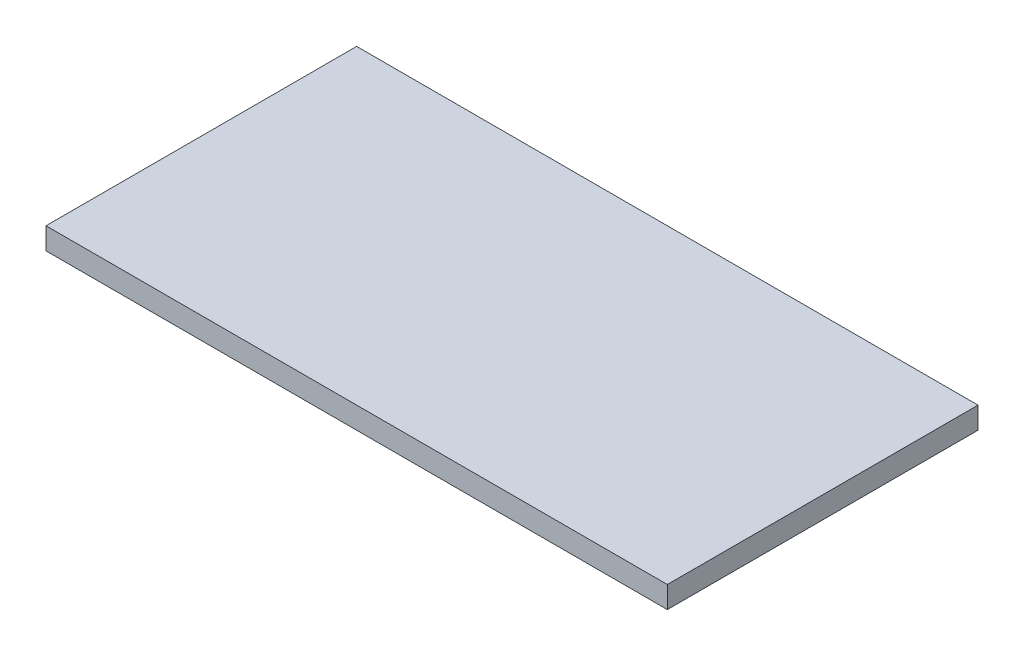
from build123d import *

# Parameters (mm, degrees)
SKETCH1_W           = 20
SKETCH1_H           = 10
BOSS_EXTRUDE1_DEPTH = 0.7


with BuildPart() as part:
    # Sketch1 → Boss-Extrude1 (new body)
    with BuildSketch(Plane(origin=(0, 0, 0), x_dir=(1, 0, 0), z_dir=(0, 1, 0))):
        Rectangle(SKETCH1_W, SKETCH1_H)
    extrude(amount=BOSS_EXTRUDE1_DEPTH)


solid = part.part
